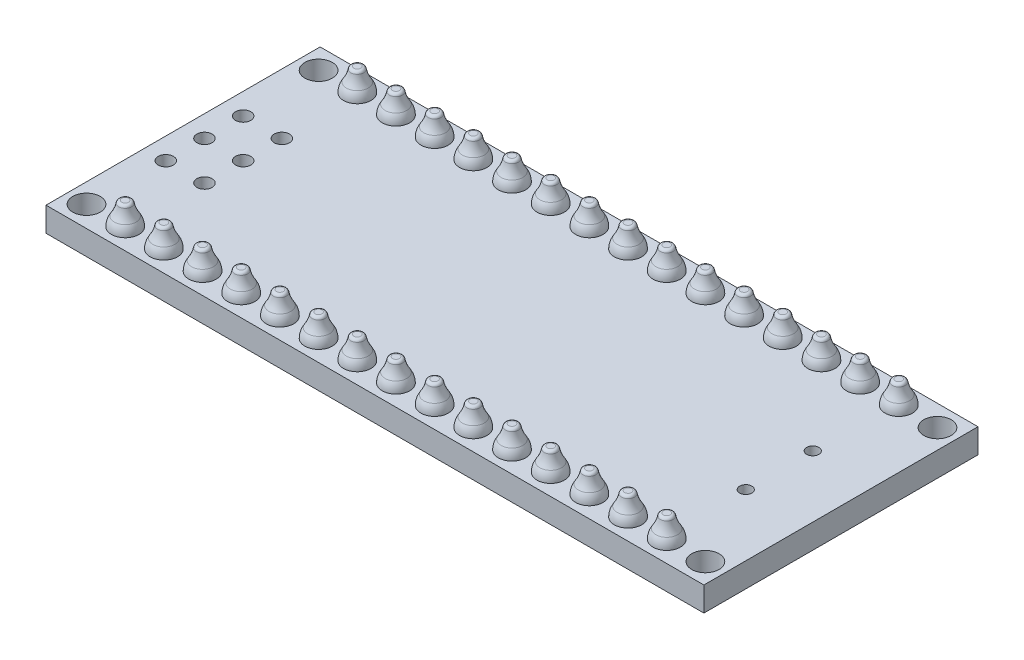
from build123d import *

# Parameters (mm, degrees)
SKETCH1_W            = 43.2
SKETCH1_H            = 18
BOSS_EXTRUDE2_DEPTH  = 1.6
SKETCH2_R            = 0.45
CUT_EXTRUDE2_DEPTH   = 1.6
LPATTERN1_COUNT      = 15
LPATTERN1_PITCH      = 2.54
SKETCH3_R            = 0.5
CUT_EXTRUDE4_DEPTH   = 1.6
SKETCH4_R            = 0.9
CUT_EXTRUDE5_DEPTH   = 1.6
LPATTERN2_COUNT      = 2
LPATTERN2_PITCH      = 15.24
LPATTERN2_COUNT_DIR2 = 15
LPATTERN2_PITCH_DIR2 = 2.54
LPATTERN3_COUNT      = 2
LPATTERN3_PITCH      = 2.54
LPATTERN3_COUNT_DIR2 = 3
LPATTERN3_PITCH_DIR2 = 2.54
SKETCH9_R            = 0.4
CUT_EXTRUDE6_DEPTH   = 10


with BuildPart() as part:
    # Sketch1 → Boss-Extrude2 (new body)
    with BuildSketch(Plane(origin=(0, 0, 0), x_dir=(1, 0, 0), z_dir=(0, 1, 0))):
        with Locations((17.78, 7.62)):
            Rectangle(SKETCH1_W, SKETCH1_H)
    extrude(amount=BOSS_EXTRUDE2_DEPTH)

    # Sketch2 → Cut-Extrude2 (cut)
    with BuildSketch(Plane(origin=(0, 0, 0), x_dir=(1, 0, 0), z_dir=(0, 1, 0))):
        with Locations(Location((0, 0, 0), (0, 0, 270))):
            Circle(SKETCH2_R)
        with Locations(Location((0, 15.24, 0), (0, 0, 270))):
            Circle(SKETCH2_R)
    cut_extrude2 = extrude(amount=CUT_EXTRUDE2_DEPTH, mode=Mode.SUBTRACT)

    # LPattern1: Cut-Extrude2 ×15
    with Locations(*[(i * LPATTERN1_PITCH, 0, 0) for i in range(1, LPATTERN1_COUNT)]):
        add(cut_extrude2, mode=Mode.SUBTRACT)

    # Sketch3 → Cut-Extrude4 (cut)
    with BuildSketch(Plane(origin=(0, 0, 0), x_dir=(1, 0, 0), z_dir=(0, 1, 0))):
        with Locations(Location((0.127, 10.16, 0), (0, 0, 270))):
            Circle(SKETCH3_R)
        with Locations(Location((-2.413, 10.16, 0), (0, 0, 270))):
            Circle(SKETCH3_R)
        with Locations(Location((-2.413, 7.62, 0), (0, 0, 270))):
            Circle(SKETCH3_R)
        with Locations(Location((-2.413, 5.08, 0), (0, 0, 270))):
            Circle(SKETCH3_R)
        with Locations(Location((0.127, 5.08, 0), (0, 0, 270))):
            Circle(SKETCH3_R)
        with Locations(Location((0.127, 7.62, 0), (0, 0, 270))):
            Circle(SKETCH3_R)
    extrude(amount=CUT_EXTRUDE4_DEPTH, mode=Mode.SUBTRACT)

    # Sketch4 → Cut-Extrude5 (cut)
    with BuildSketch(Plane(origin=(0, 0, 0), x_dir=(1, 0, 0), z_dir=(0, 1, 0))):
        with Locations(Location((38.1, 15.24, 0), (0, 0, 270))):
            Circle(SKETCH4_R)
        with Locations(Location((38.1, 0, 0), (0, 0, 270))):
            Circle(SKETCH4_R)
        with Locations(Location((-2.54, 0, 0), (0, 0, 270))):
            Circle(SKETCH4_R)
        with Locations(Location((-2.54, 15.24, 0), (0, 0, 270))):
            Circle(SKETCH4_R)
    extrude(amount=CUT_EXTRUDE5_DEPTH, mode=Mode.SUBTRACT)

    # Sketch6 → Revolve1 (revolve)
    with BuildSketch(Plane(origin=(0, 0, 0), x_dir=(0, 0, -1), z_dir=(1, 0, 0))):
        with BuildLine():
            Line((0, 1.6), (0.9, 1.6))
            ThreePointArc((0.9, 1.6), (0.852442497, 1.91994498), (0.713882199, 2.212224898))
            ThreePointArc((0.713882199, 2.212224898), (0.530499248, 2.558589224), (0.422081551, 2.93520993))
            ThreePointArc((0.422081551, 2.93520993), (0.353575878, 3.053365554), (0.225205293, 3.1))
            Line((0.225205293, 3.1), (0, 3.1))
            Line((0, 3.1), (0, 1.6))
        make_face()
    revolve1 = revolve(axis=Axis((0, 1.372239532, 0), (0, 1, 0)))

    # LPattern2: Revolve1 2 × 15
    with Locations(*[(j * LPATTERN2_PITCH_DIR2, 0, -i * LPATTERN2_PITCH) for i in range(LPATTERN2_COUNT) for j in range(LPATTERN2_COUNT_DIR2) if (i, j) != (0, 0)]):
        add(revolve1)

    # Sketch7 → Revolve2 (revolve)
    with BuildSketch(Plane.XY.offset(-5.08), mode=Mode.PRIVATE) as revolve2_sk:
        with BuildLine():
            Line((0.127, 0), (1.027, 0))
            ThreePointArc((1.027, 0), (0.970551628, -0.347850543), (0.807, -0.66))
            ThreePointArc((0.807, -0.66), (0.629174555, -0.974977034), (0.537980562, -1.325))
            ThreePointArc((0.537980562, -1.325), (0.471836779, -1.45), (0.339549213, -1.5))
            Line((0.339549213, -1.5), (0.127, -1.5))
            Line((0.127, -1.5), (0.127, 0))
        make_face()
    revolve2 = revolve(revolve2_sk.sketch.rotate(Axis((0.127, 3.888986093, -5.08), (0, -1, 0)), 90), axis=Axis((0.127, 3.888986093, -5.08), (0, -1, 0)))

    # LPattern3: Revolve2 2 × 3
    with Locations(*[(-i * LPATTERN3_PITCH, 0, -j * LPATTERN3_PITCH_DIR2) for i in range(LPATTERN3_COUNT) for j in range(LPATTERN3_COUNT_DIR2) if (i, j) != (0, 0)]):
        add(revolve2)

    # Sketch9 → Cut-Extrude6 (cut)
    with BuildSketch(Plane(origin=(0, 0, 0), x_dir=(1, 0, 0), z_dir=(0, 1, 0))):
        with Locations(Location((35.33, 5.42, 0), (0, 0, 270))):
            Circle(SKETCH9_R)
        with Locations(Location((35.33, 9.82, 0), (0, 0, 270))):
            Circle(SKETCH9_R)
    extrude(amount=CUT_EXTRUDE6_DEPTH, mode=Mode.SUBTRACT)


solid = part.part
